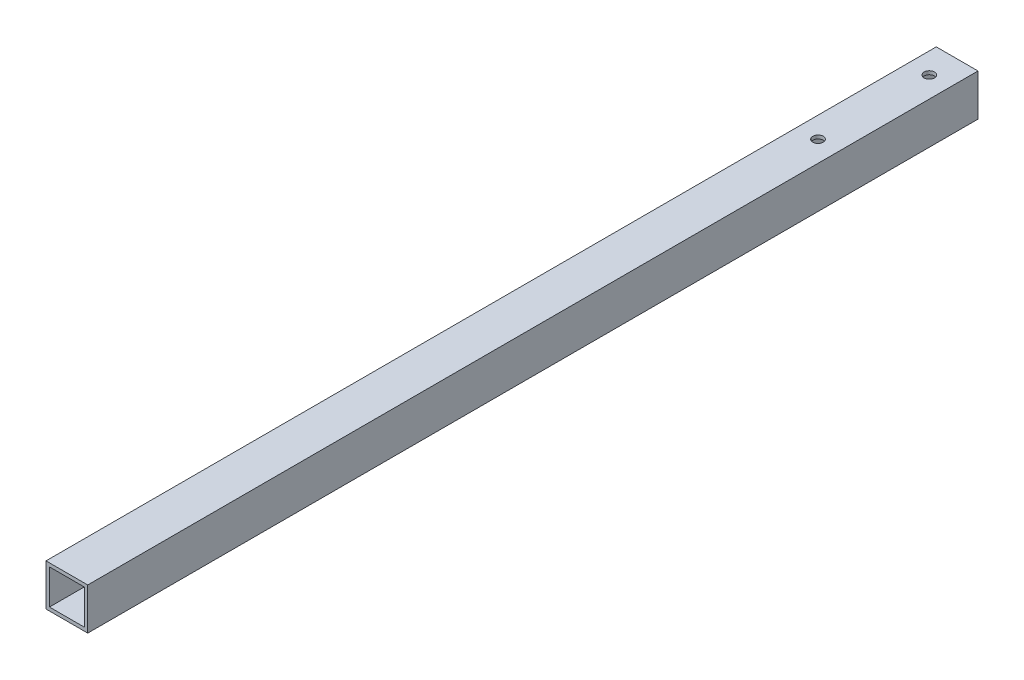
from build123d import *

# Parameters (mm, degrees)
SKETCH1_W               = 19.05
SKETCH1_H               = 19.05
SKETCH1_W_2             = 15.875
SKETCH1_H_2             = 15.875
BOSS_EXTRUDE1_DEPTH     = 406.4
CUT_EXTRUDE1_DEPTH      = 407.623180906
CUT_EXTRUDE1_DEPTH_BACK = 407.623180906
SKETCH2_R               = 2.38125


with BuildPart() as part:
    # Sketch1 → Boss-Extrude1 (new body)
    with BuildSketch(Plane.XY):
        Rectangle(SKETCH1_W, SKETCH1_H)
        Rectangle(SKETCH1_W_2, SKETCH1_H_2, mode=Mode.SUBTRACT)
    extrude(amount=BOSS_EXTRUDE1_DEPTH)

    # Sketch2 → Cut-Extrude1 (cut, two sides: drawn at the far end of the back side and taken through both)
    with BuildSketch(Plane(origin=(0, 0, 0), x_dir=(1, 0, 0), z_dir=(0, 1, 0)).offset(-CUT_EXTRUDE1_DEPTH_BACK)):
        with Locations(Location((0, -12.7, 0), (0, 0, 270))):
            Circle(SKETCH2_R)
        with Locations(Location((0, -63.5, 0), (0, 0, 270))):
            Circle(SKETCH2_R)
    extrude(amount=CUT_EXTRUDE1_DEPTH + CUT_EXTRUDE1_DEPTH_BACK, mode=Mode.SUBTRACT)


solid = part.part
